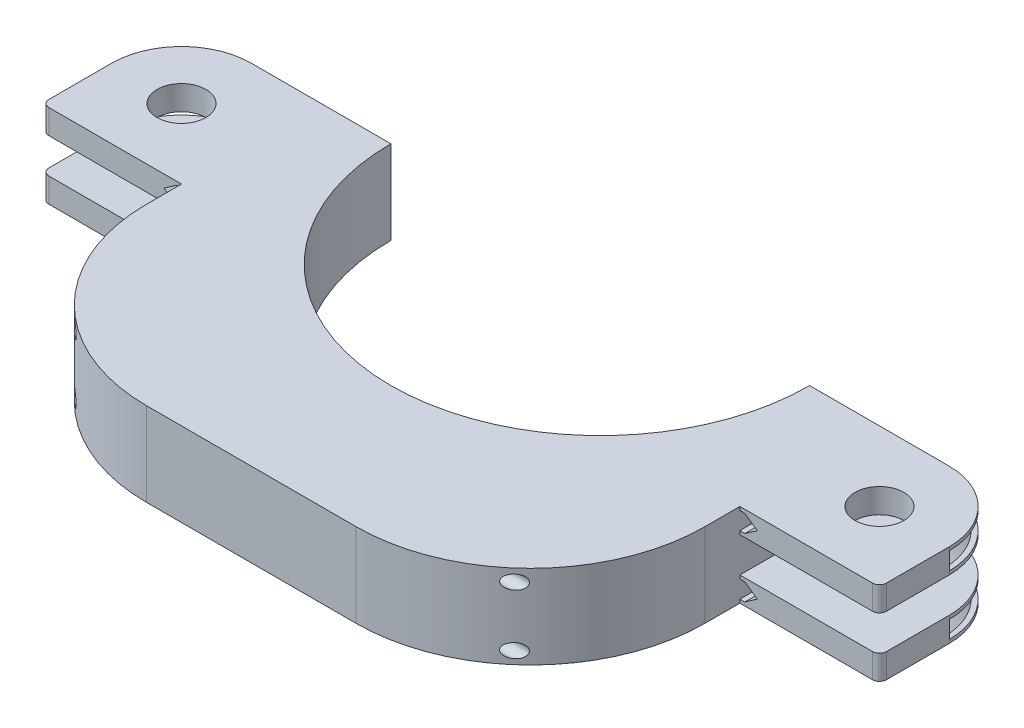
from build123d import *

# Parameters (mm, degrees)
SKETCH3_R            = 1.75
BOSS_EXTRUDE1_DEPTH  = 6
SKETCH4_W            = 10
SKETCH4_H            = 2.5
CUT_EXTRUDE1_DEPTH   = 10
CUT_REVOLVE1_ANGLE   = 180
CUT_EXTRUDE2_DEPTH   = 5
SKETCH10_R           = 0.5
CUT_EXTRUDE3_DEPTH   = 40
MIRROR6_COPY_1_ANGLE = 180
MIRROR6_COPY_2_DEPTH = 5
CUT_EXTRUDE4_DEPTH   = 6


with BuildPart() as part:
    # Sketch3 → Boss-Extrude1 (new body)
    with BuildSketch(Plane(origin=(0, 0, 0), x_dir=(1, 0, 0), z_dir=(0, 1, 0))):
        with BuildLine():
            Line((-23.265306122, 15.612244898), (16.734693878, 15.612244898))
            Line((16.734693878, 15.612244898), (21.734693878, 15.612244898))
            ThreePointArc((21.734693878, 15.612244898), (25.270227783, 14.147778804), (26.734693878, 10.612244898))
            Line((26.734693878, 10.612244898), (26.734693878, 6.112244898))
            ThreePointArc((26.734693878, 6.112244898), (26.588247268, 5.758691507), (26.234693878, 5.612244898))
            Line((26.234693878, 5.612244898), (16.734693878, 5.612244898))
            Line((16.734693878, 5.612244898), (16.734693878, 3.112244898))
            ThreePointArc((16.734693878, 3.112244898), (13.073528642, -5.726589867), (4.234693878, -9.387755102))
            Line((4.234693878, -9.387755102), (-10.765306122, -9.387755102))
            ThreePointArc((-10.765306122, -9.387755102), (-19.604140887, -5.726589867), (-23.265306122, 3.112244898))
            Line((-23.265306122, 3.112244898), (-23.265306122, 5.612244898))
            Line((-23.265306122, 5.612244898), (-32.765306122, 5.612244898))
            ThreePointArc((-32.765306122, 5.612244898), (-33.118859513, 5.758691507), (-33.265306122, 6.112244898))
            Line((-33.265306122, 6.112244898), (-33.265306122, 10.612244898))
            ThreePointArc((-33.265306122, 10.612244898), (-31.800840028, 14.147778804), (-28.265306122, 15.612244898))
            Line((-28.265306122, 15.612244898), (-23.265306122, 15.612244898))
        make_face()
        with Locations((21.734693878, 10.612244898)):
            Circle(SKETCH3_R, mode=Mode.SUBTRACT)
        with Locations((-28.265306122, 10.612244898)):
            Circle(SKETCH3_R, mode=Mode.SUBTRACT)
    extrude(amount=BOSS_EXTRUDE1_DEPTH)

    # Sketch4 → Cut-Extrude1 (cut)
    with BuildSketch(Plane(origin=(0, 0, -15.612244898), x_dir=(-1, 0, 0), z_dir=(0, 0, -1))):
        with Locations((28.265306122, 3)):
            Rectangle(SKETCH4_W, SKETCH4_H)
        with Locations((-21.734693878, 3)):
            Rectangle(SKETCH4_W, SKETCH4_H)
    extrude(amount=-CUT_EXTRUDE1_DEPTH, mode=Mode.SUBTRACT)

    # Sketch7 → Cut-Revolve1 (revolve, cut)
    with BuildSketch(Plane.XY.offset(-10.612244898)):
        Polygon((-33.265306122, 1.496669927), (-32.907482363, 1.496669927), (-32.015306122, 0.873334963), (-32.907482363, 0.25), (-33.265306122, 0.25), align=None)
    cut_revolve1 = revolve(axis=Axis((-28.265306122, 1.746669927, -10.612244898), (0, -1, 0)), revolution_arc=CUT_REVOLVE1_ANGLE, mode=Mode.SUBTRACT)

    # Sketch9 → Cut-Extrude2 (cut)
    with BuildSketch(Plane.XY.offset(-5.612244898)):
        Polygon((-23.623129882, 0.253330073), (-24.515306122, 0.876665037), (-23.623129882, 1.5), (-23.265306122, 1.5), (-23.265306122, 0.253330073), align=None)
    cut_extrude2 = extrude(amount=-CUT_EXTRUDE2_DEPTH, mode=Mode.SUBTRACT)

    # Sketch10 → Cut-Extrude3 (cut)
    with BuildSketch(Plane.ZY.offset(23.265306122)):
        with Locations((6.262755102, 0.875)):
            Circle(SKETCH10_R)
    cut_extrude3 = extrude(amount=-CUT_EXTRUDE3_DEPTH, mode=Mode.SUBTRACT)

    # Mirror5: Cut-Revolve1, Cut-Extrude2 across plane
    add(cut_revolve1.mirror(Plane.ZY.offset(3.265306122)), mode=Mode.SUBTRACT)
    add(cut_extrude2.mirror(Plane.ZY.offset(3.265306122)), mode=Mode.SUBTRACT)

    # Mirror6: Cut-Revolve1, Cut-Extrude2, Cut-Extrude3 across plane
    add(cut_revolve1.mirror(Plane.ZX.offset(3)), mode=Mode.SUBTRACT)
    add(cut_extrude2.mirror(Plane.ZX.offset(3)), mode=Mode.SUBTRACT)
    add(cut_extrude3.mirror(Plane.ZX.offset(3)), mode=Mode.SUBTRACT)

    # Mirror6 copy 1 sketch → Mirror6 copy 1 (revolve, cut)
    with BuildSketch(Plane(origin=(-6.530612245, 6, -10.612244898), x_dir=(-1, 0, 0), z_dir=(0, 0, 1))):
        Polygon((-33.265306122, 1.496669927), (-32.907482363, 1.496669927), (-32.015306122, 0.873334963), (-32.907482363, 0.25), (-33.265306122, 0.25), align=None)
    revolve(axis=Axis((21.734693878, 4.253330073, -10.612244898), (0, 1, 0)), revolution_arc=MIRROR6_COPY_1_ANGLE, mode=Mode.SUBTRACT)

    # Mirror6 copy 2 sketch → Mirror6 copy 2 (cut)
    with BuildSketch(Plane(origin=(-6.530612245, 6, -5.612244898), x_dir=(-1, 0, 0), z_dir=(0, 0, 1))):
        Polygon((-23.623129882, 0.253330073), (-24.515306122, 0.876665037), (-23.623129882, 1.5), (-23.265306122, 1.5), (-23.265306122, 0.253330073), align=None)
    extrude(amount=-MIRROR6_COPY_2_DEPTH, mode=Mode.SUBTRACT)

    # Sketch11 → Cut-Extrude4 (cut)
    with BuildSketch(Plane.XZ):
        with BuildLine():
            Line((11.734693878, -15.612244898), (-18.265306122, -15.612244898))
            ThreePointArc((-18.265306122, -15.612244898), (-3.265306122, -0.612244898), (11.734693878, -15.612244898))
        make_face()
    extrude(amount=-CUT_EXTRUDE4_DEPTH, mode=Mode.SUBTRACT)


solid = part.part
